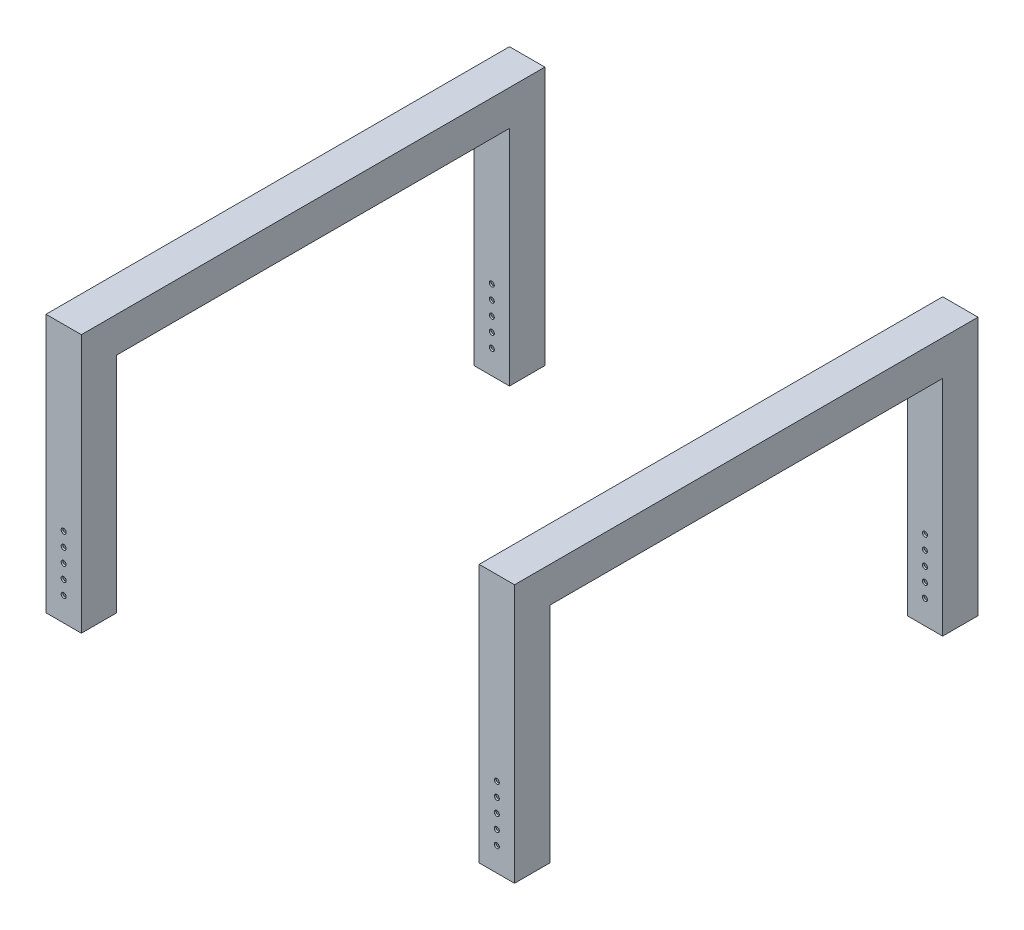
from build123d import *

# Parameters (mm, degrees)
CROQUIS1_W                = 88.9
CROQUIS1_H                = 88.9
SALIENTE_EXTRUIR1_DEPTH   = 650
SALIENTE_EXTRUIR1_2_DEPTH = 650
SALIENTE_EXTRUIR1_3_DEPTH = 650
SALIENTE_EXTRUIR1_4_DEPTH = 650
CROQUIS7_W                = 80
CROQUIS7_H                = 80
CORTAR_EXTRUIR5_DEPTH     = 550
CROQUIS8_W                = 80
CROQUIS8_H                = 80
CORTAR_EXTRUIR6_DEPTH     = 550
CROQUIS9_R                = 6.35
CORTAR_EXTRUIR7_DEPTH     = 1200
CROQUIS10_R               = 6.35
CORTAR_EXTRUIR8_DEPTH     = 1200
CROQUIS12_W               = 88.9
CROQUIS12_H               = 88.9
SALIENTE_EXTRUIR3_DEPTH   = 987.3
CROQUIS13_W               = 88.9
CROQUIS13_H               = 88.9
SALIENTE_EXTRUIR4_DEPTH   = 987.3


with BuildPart() as part:
    # Croquis1 → Saliente-Extruir1 (new body)
    with BuildSketch(Plane(origin=(0, 0, 0), x_dir=(1, 0, 0), z_dir=(0, 1, 0))):
        with Locations((44.45, -44.45)):
            Rectangle(CROQUIS1_W, CROQUIS1_H)
    extrude(amount=SALIENTE_EXTRUIR1_DEPTH)


with BuildPart() as body_2:
    # Croquis1 → Saliente-Extruir1 2 (new body)
    with BuildSketch(Plane(origin=(0, 0, 0), x_dir=(1, 0, 0), z_dir=(0, 1, 0))):
        with Locations((1133.35, -44.45)):
            Rectangle(CROQUIS1_W, CROQUIS1_H)
    extrude(amount=SALIENTE_EXTRUIR1_2_DEPTH)


with BuildPart() as body_3:
    # Croquis1 → Saliente-Extruir1 3 (new body)
    with BuildSketch(Plane(origin=(0, 0, 0), x_dir=(1, 0, 0), z_dir=(0, 1, 0))):
        with Locations((1133.35, -1120.65)):
            Rectangle(CROQUIS1_W, CROQUIS1_H)
    extrude(amount=SALIENTE_EXTRUIR1_3_DEPTH)


with BuildPart() as body_4:
    # Croquis1 → Saliente-Extruir1 4 (new body)
    with BuildSketch(Plane(origin=(0, 0, 0), x_dir=(1, 0, 0), z_dir=(0, 1, 0))):
        with Locations((44.45, -1120.65)):
            Rectangle(CROQUIS1_W, CROQUIS1_H)
    extrude(amount=SALIENTE_EXTRUIR1_4_DEPTH)


with BuildPart() as cortar_extruir5_tool:
    # Croquis7 → Cortar-Extruir5 (new body)
    with BuildSketch(Plane.XZ):
        with Locations((1133.35, 44.45)):
            Rectangle(CROQUIS7_W, CROQUIS7_H)
        with Locations((44.45, 44.45)):
            Rectangle(CROQUIS7_W, CROQUIS7_H)
    extrude(amount=-CORTAR_EXTRUIR5_DEPTH)


with BuildPart() as part_1:
    add(part.part)

    # Cortar-Extruir5: cut by cortar_extruir5_tool
    add(cortar_extruir5_tool.part, mode=Mode.SUBTRACT)


with BuildPart() as body_2_1:
    add(body_2.part)

    # Cortar-Extruir5: cut by cortar_extruir5_tool
    add(cortar_extruir5_tool.part, mode=Mode.SUBTRACT)


with BuildPart() as cortar_extruir6_tool:
    # Croquis8 → Cortar-Extruir6 (new body)
    with BuildSketch(Plane.XZ):
        with Locations((1133.35, 1120.65)):
            Rectangle(CROQUIS8_W, CROQUIS8_H)
        with Locations((44.45, 1120.65)):
            Rectangle(CROQUIS8_W, CROQUIS8_H)
    extrude(amount=-CORTAR_EXTRUIR6_DEPTH)


with BuildPart() as body_3_1:
    add(body_3.part)

    # Cortar-Extruir6: cut by cortar_extruir6_tool
    add(cortar_extruir6_tool.part, mode=Mode.SUBTRACT)


with BuildPart() as body_4_1:
    add(body_4.part)

    # Cortar-Extruir6: cut by cortar_extruir6_tool
    add(cortar_extruir6_tool.part, mode=Mode.SUBTRACT)


with BuildPart() as cortar_extruir7_tool:
    # Croquis9 → Cortar-Extruir7 (new body)
    with BuildSketch(Plane.XY.offset(1165.1)):
        with Locations((44.45, 60)):
            Circle(CROQUIS9_R)
        with Locations((44.45, 95)):
            Circle(CROQUIS9_R)
        with Locations((44.45, 130)):
            Circle(CROQUIS9_R)
        with Locations((44.45, 165)):
            Circle(CROQUIS9_R)
        with Locations((44.45, 200)):
            Circle(CROQUIS9_R)
    extrude(amount=-CORTAR_EXTRUIR7_DEPTH)


with BuildPart() as part_2:
    add(part_1.part)

    # Cortar-Extruir7: cut by cortar_extruir7_tool
    add(cortar_extruir7_tool.part, mode=Mode.SUBTRACT)



with BuildPart() as body_4_2:
    add(body_4_1.part)

    # Cortar-Extruir7: cut by cortar_extruir7_tool
    add(cortar_extruir7_tool.part, mode=Mode.SUBTRACT)


with BuildPart() as cortar_extruir8_tool:
    # Croquis10 → Cortar-Extruir8 (new body)
    with BuildSketch(Plane.XY.offset(1165.1)):
        with Locations((1133.35, 60)):
            Circle(CROQUIS10_R)
        with Locations((1133.35, 95)):
            Circle(CROQUIS10_R)
        with Locations((1133.35, 130)):
            Circle(CROQUIS10_R)
        with Locations((1133.35, 165)):
            Circle(CROQUIS10_R)
        with Locations((1133.35, 200)):
            Circle(CROQUIS10_R)
    extrude(amount=-CORTAR_EXTRUIR8_DEPTH)


with BuildPart() as body_2_2:
    add(body_2_1.part)

    # Cortar-Extruir8: cut by cortar_extruir8_tool
    add(cortar_extruir8_tool.part, mode=Mode.SUBTRACT)



with BuildPart() as body_3_2:
    add(body_3_1.part)

    # Cortar-Extruir8: cut by cortar_extruir8_tool
    add(cortar_extruir8_tool.part, mode=Mode.SUBTRACT)


with BuildPart() as part_3:
    add(part_2.part)

    add(body_4_2.part)  # Saliente-Extruir3 merges body 4
    # Croquis12 → Saliente-Extruir3 (add)
    with BuildSketch(Plane.XY.offset(88.9)):
        with Locations((44.45, 605.55)):
            Rectangle(CROQUIS12_W, CROQUIS12_H)
    extrude(amount=SALIENTE_EXTRUIR3_DEPTH)


with BuildPart() as body_2_3:
    add(body_2_2.part)

    add(body_3_2.part)  # Saliente-Extruir4 merges body 3
    # Croquis13 → Saliente-Extruir4 (add)
    with BuildSketch(Plane.XY.offset(88.9)):
        with Locations((1133.35, 605.55)):
            Rectangle(CROQUIS13_W, CROQUIS13_H)
    extrude(amount=SALIENTE_EXTRUIR4_DEPTH)


solid = Compound([part_3.part, body_2_3.part])
